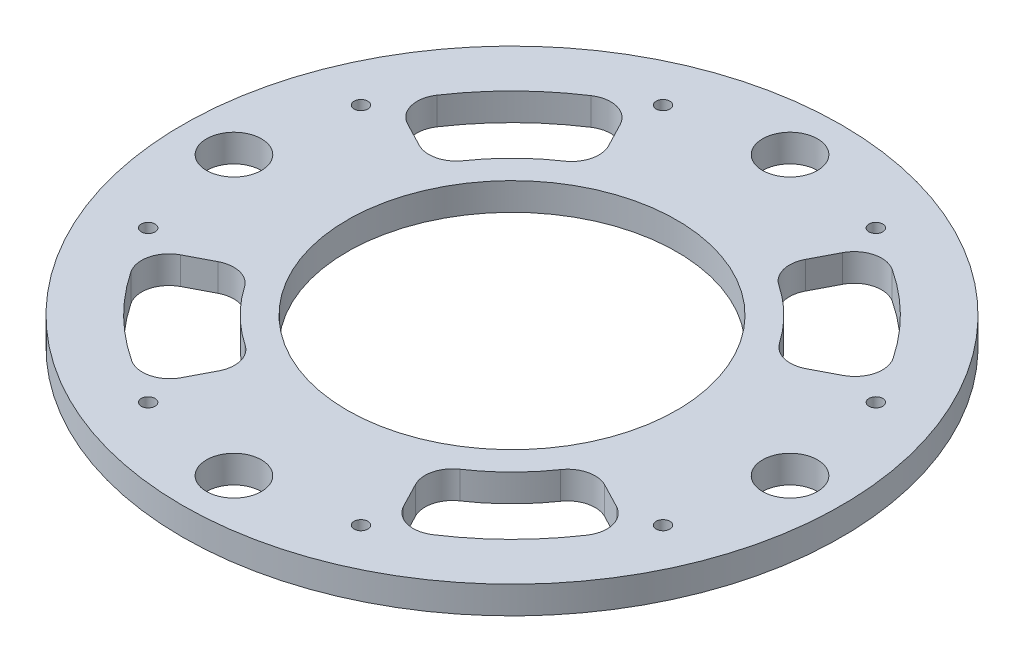
from build123d import *

# Parameters (mm, degrees)
SKETCH1_R           = 76.2
BOSS_EXTRUDE1_DEPTH = 6.35
SKETCH2_R           = 35
CUT_EXTRUDE1_DEPTH  = 6.35
SKETCH3_R           = 6.35
CUT_EXTRUDE2_DEPTH  = 10
SKETCH7_R           = 1.5875
CUT_EXTRUDE4_DEPTH  = 10
SKETCH8_R           = 6.35
CUT_EXTRUDE5_DEPTH  = 10
SKETCH9_R           = 38.1
CUT_EXTRUDE6_DEPTH  = 10
CUT_EXTRUDE10_DEPTH = 10


with BuildPart() as part:
    # Sketch1 → Boss-Extrude1 (new body)
    with BuildSketch(Plane(origin=(0, 0, 0), x_dir=(1, 0, 0), z_dir=(0, 1, 0))):
        with Locations(Location((0, 0, 0), (0, 0, 270))):
            Circle(SKETCH1_R)
    extrude(amount=BOSS_EXTRUDE1_DEPTH)

    # Sketch2 → Cut-Extrude1 (cut)
    with BuildSketch(Plane(origin=(0, 6.35, 0), x_dir=(1, 0, 0), z_dir=(0, 1, 0))):
        with Locations(Location((0, 0, 0), (0, 0, 270))):
            Circle(SKETCH2_R)
    extrude(amount=-CUT_EXTRUDE1_DEPTH, mode=Mode.SUBTRACT)

    # Sketch3 → Cut-Extrude2 (cut)
    with BuildSketch(Plane(origin=(0, 6.35, 0), x_dir=(1, 0, 0), z_dir=(0, 1, 0))):
        with Locations(Location((-64.2875, 0, 0), (0, 0, 270))):
            Circle(SKETCH3_R)
        with Locations(Location((64.2875, 0, 0), (0, 0, 270))):
            Circle(SKETCH3_R)
    extrude(amount=-CUT_EXTRUDE2_DEPTH, mode=Mode.SUBTRACT)

    # Sketch7 → Cut-Extrude4 (cut)
    with BuildSketch(Plane(origin=(0, 6.35, 0), x_dir=(1, 0, 0), z_dir=(0, 1, 0))):
        with Locations(Location((-24.5999, 59.5249, 0), (0, 0, 270))):
            Circle(SKETCH7_R)
        with Locations(Location((24.5999, 59.5249, 0), (0, 0, 270))):
            Circle(SKETCH7_R)
        with Locations(Location((24.5999, -59.5249, 0), (0, 0, 270))):
            Circle(SKETCH7_R)
        with Locations(Location((-24.5999, -59.5249, 0), (0, 0, 270))):
            Circle(SKETCH7_R)
        with Locations(Location((-59.5249, 24.5999, 0), (0, 0, 270))):
            Circle(SKETCH7_R)
        with Locations(Location((-59.5249, -24.5999, 0), (0, 0, 270))):
            Circle(SKETCH7_R)
        with Locations(Location((59.5249, 24.5999, 0), (0, 0, 270))):
            Circle(SKETCH7_R)
        with Locations(Location((59.5249, -24.5999, 0), (0, 0, 270))):
            Circle(SKETCH7_R)
    extrude(amount=-CUT_EXTRUDE4_DEPTH, mode=Mode.SUBTRACT)

    # Sketch8 → Cut-Extrude5 (cut)
    with BuildSketch(Plane(origin=(0, 6.35, 0), x_dir=(1, 0, 0), z_dir=(0, 1, 0))):
        with Locations(Location((-64.2875, 0, 0), (0, 0, 270))):
            Circle(SKETCH8_R)
        with Locations(Location((64.2875, 0, 0), (0, 0, 270))):
            Circle(SKETCH8_R)
        with Locations(Location((0, -64.2875, 0), (0, 0, 270))):
            Circle(SKETCH8_R)
        with Locations(Location((0, 64.2875, 0), (0, 0, 270))):
            Circle(SKETCH8_R)
    extrude(amount=-CUT_EXTRUDE5_DEPTH, mode=Mode.SUBTRACT)

    # Sketch9 → Cut-Extrude6 (cut)
    with BuildSketch(Plane(origin=(0, 6.35, 0), x_dir=(1, 0, 0), z_dir=(0, 1, 0))):
        with Locations(Location((0, 0, 0), (0, 0, 270))):
            Circle(SKETCH9_R)
    extrude(amount=-CUT_EXTRUDE6_DEPTH, mode=Mode.SUBTRACT)

    # Sketch10 → Cut-Extrude10 (cut)
    with BuildSketch(Plane(origin=(0, 6.35, 0), x_dir=(1, 0, 0), z_dir=(0, 1, 0))):
        with BuildLine():
            Line((-22.744667262, 45.067306456), (-25.69340518, 50.731779293))
            ThreePointArc((-25.69340518, 50.731779293), (-29.722021798, 53.943778286), (-34.806582189, 53.110750666))
            ThreePointArc((-34.806582189, 53.110750666), (-44.649726855, 45.151432888), (-52.718528787, 35.397834998))
            ThreePointArc((-52.718528787, 35.397834998), (-53.599643338, 30.28850003), (-50.378779602, 26.225532708))
            Line((-50.378779602, 26.225532708), (-44.706731925, 23.272851578))
            ThreePointArc((-44.706731925, 23.272851578), (-40.248145008, 22.741576978), (-36.552799702, 25.292199073))
            ThreePointArc((-36.552799702, 25.292199073), (-31.232430693, 31.628116811), (-24.830037796, 36.868302416))
            ThreePointArc((-24.830037796, 36.868302416), (-22.223123282, 40.56995153), (-22.744667262, 45.067306456))
        make_face()
        with BuildLine():
            ThreePointArc((24.830037796, 36.868302416), (22.223123282, 40.56995153), (22.744667262, 45.067306456))
            Line((22.744667262, 45.067306456), (25.69340518, 50.731779293))
            ThreePointArc((25.69340518, 50.731779293), (29.722021798, 53.943778286), (34.806582189, 53.110750666))
            ThreePointArc((34.806582189, 53.110750666), (44.649726855, 45.151432888), (52.718528787, 35.397834998))
            ThreePointArc((52.718528787, 35.397834998), (53.599643338, 30.28850003), (50.378779602, 26.225532708))
            Line((50.378779602, 26.225532708), (44.706731925, 23.272851578))
            ThreePointArc((44.706731925, 23.272851578), (40.248145008, 22.741576978), (36.552799702, 25.292199073))
            ThreePointArc((36.552799702, 25.292199073), (31.232430693, 31.628116811), (24.830037796, 36.868302416))
        make_face()
        with BuildLine():
            Line((22.744667262, -45.067306456), (25.69340518, -50.731779293))
            ThreePointArc((25.69340518, -50.731779293), (29.722021798, -53.943778286), (34.806582189, -53.110750666))
            ThreePointArc((34.806582189, -53.110750666), (44.649726855, -45.151432888), (52.718528787, -35.397834998))
            ThreePointArc((52.718528787, -35.397834998), (53.599643338, -30.28850003), (50.378779602, -26.225532708))
            Line((50.378779602, -26.225532708), (44.706731925, -23.272851578))
            ThreePointArc((44.706731925, -23.272851578), (40.248145008, -22.741576978), (36.552799702, -25.292199073))
            ThreePointArc((36.552799702, -25.292199073), (31.232430693, -31.628116811), (24.830037796, -36.868302416))
            ThreePointArc((24.830037796, -36.868302416), (22.223123282, -40.56995153), (22.744667262, -45.067306456))
        make_face()
        with BuildLine():
            ThreePointArc((-24.830037796, -36.868302416), (-22.223123282, -40.56995153), (-22.744667262, -45.067306456))
            Line((-22.744667262, -45.067306456), (-25.69340518, -50.731779293))
            ThreePointArc((-25.69340518, -50.731779293), (-29.722021798, -53.943778286), (-34.806582189, -53.110750666))
            ThreePointArc((-34.806582189, -53.110750666), (-44.649726855, -45.151432888), (-52.718528787, -35.397834998))
            ThreePointArc((-52.718528787, -35.397834998), (-53.599643338, -30.28850003), (-50.378779602, -26.225532708))
            Line((-50.378779602, -26.225532708), (-44.706731925, -23.272851578))
            ThreePointArc((-44.706731925, -23.272851578), (-40.248145008, -22.741576978), (-36.552799702, -25.292199073))
            ThreePointArc((-36.552799702, -25.292199073), (-31.232430693, -31.628116811), (-24.830037796, -36.868302416))
        make_face()
    extrude(amount=-CUT_EXTRUDE10_DEPTH, mode=Mode.SUBTRACT)


solid = part.part
